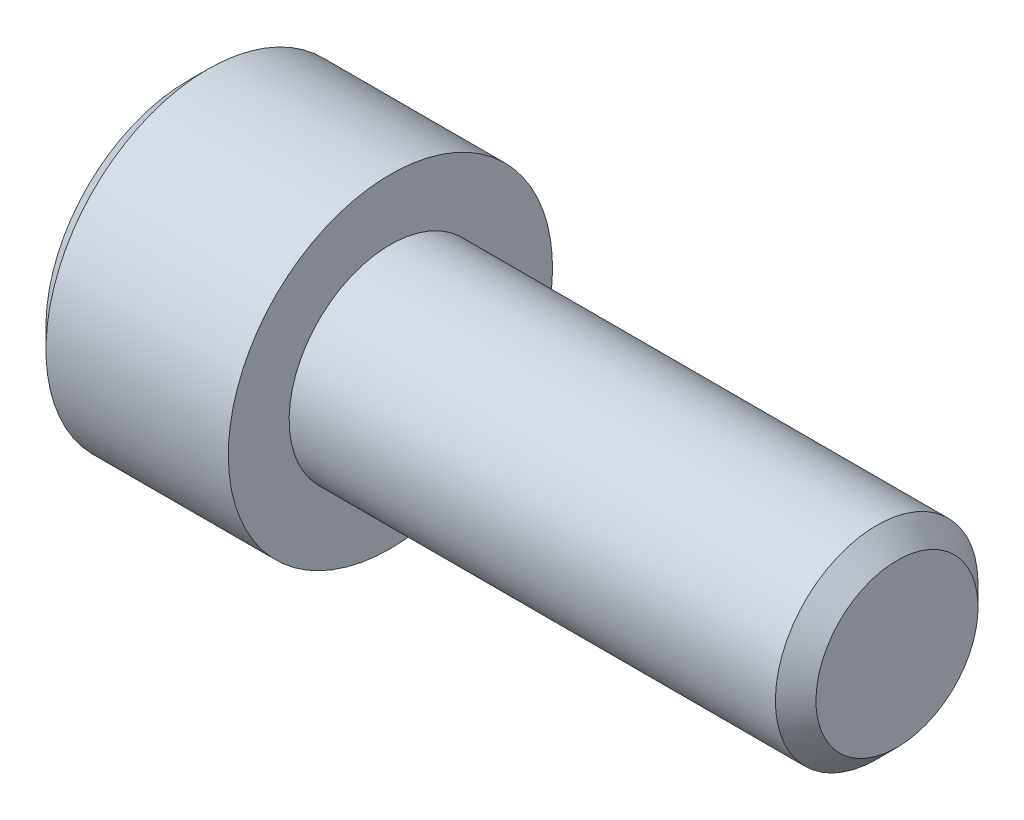
from build123d import *

# Parameters (mm, degrees)
CUT_EXTRUDE1_DEPTH = 5
CHAMFER1_SIZE      = 1


with BuildPart() as part:
    # Sketch1 → Revolve1 (revolve)
    with BuildSketch(Plane.XY, mode=Mode.PRIVATE) as revolve1_sk:
        Polygon((-10, 0), (-10, 8), (0, 8), (0, 5), (25, 5), (25, 0), align=None)
    revolve(revolve1_sk.sketch.rotate(Axis((25, 0, 0), (-1, 0, 0)), 180), axis=Axis((25, 0, 0), (-1, 0, 0)))

    # Sketch2 → Cut-Revolve1 (revolve, cut)
    with BuildSketch(Plane.XY, mode=Mode.PRIVATE) as cut_revolve1_sk:
        Polygon((-10, 0), (-10, 3.995), (-5, 3.995), (-3.929542976, 0), align=None)
    revolve(cut_revolve1_sk.sketch.rotate(Axis((-3.929542976, 0, 0), (-1, 0, 0)), 180), axis=Axis((-3.929542976, 0, 0), (-1, 0, 0)), mode=Mode.SUBTRACT)

    # Sketch3 → Cut-Extrude1 (cut)
    with BuildSketch(Plane(origin=(-10, 0, 0), x_dir=(0, 0, -1), z_dir=(1, 0, 0))):
        Polygon((0, 4.618802154), (-4, 2.309401077), (-4, -2.309401077), (0, -4.618802154), (4, -2.309401077), (4, 2.309401077), align=None)
    extrude(amount=CUT_EXTRUDE1_DEPTH, mode=Mode.SUBTRACT)

    # Chamfer1
    chamfer1_edges = [part.edges().sort_by_distance(p)[0] for p in [
        (25, 5, 0),
        (-10, 8, 0),
    ]]
    chamfer(chamfer1_edges, length=CHAMFER1_SIZE)


solid = part.part
